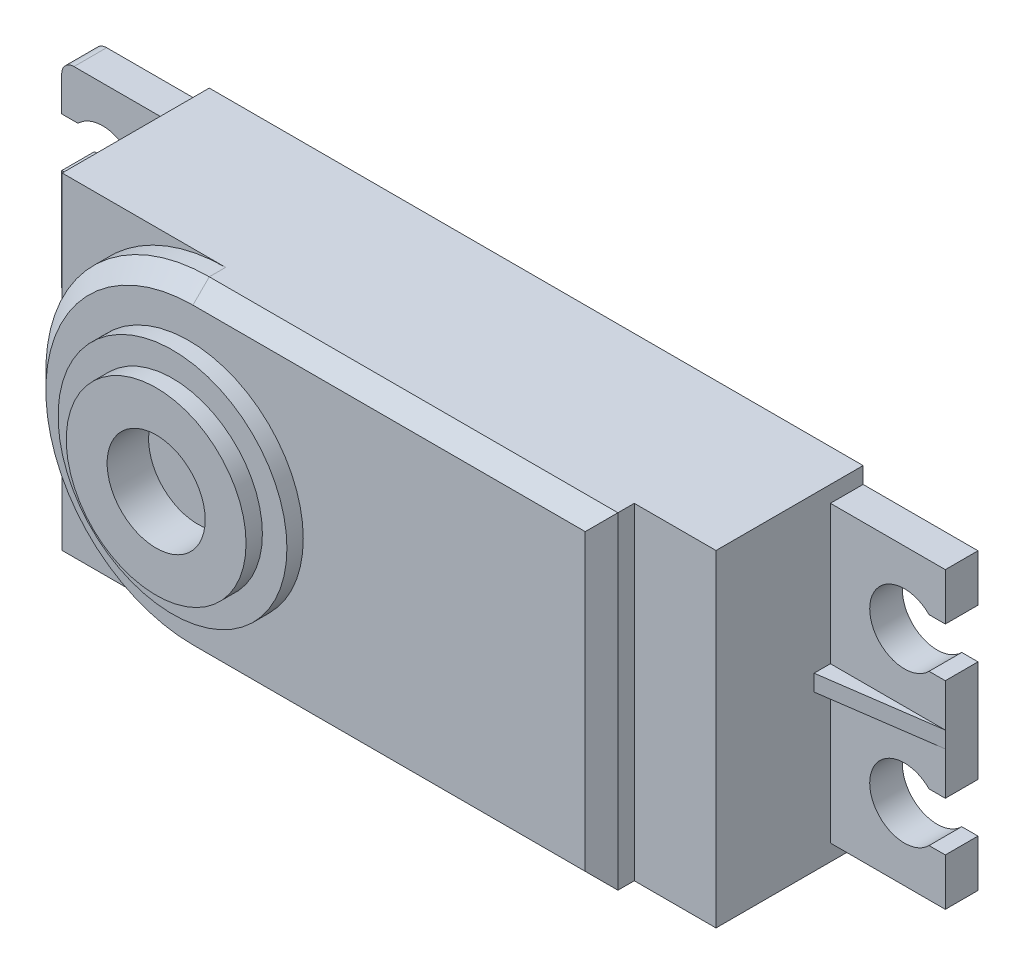
from build123d import *

# Parameters (mm, degrees)
SKETCH1_W           = 39.99992
SKETCH1_H           = 19.99996
BOSS_EXTRUDE1_DEPTH = 9.0000074
BOSS_EXTRUDE2_DEPTH = 2.00000108
CHAMFER2_SIZE       = 1.00000054
SKETCH3_R           = 6.9999987
BOSS_EXTRUDE3_DEPTH = 1.00000054
SKETCH4_R           = 5.5000017
BOSS_EXTRUDE4_DEPTH = 1.00000054
SKETCH5_R           = 2.999994
CUT_EXTRUDE1_DEPTH  = 2.54
BOSS_EXTRUDE5_DEPTH = 1.999996
FILLET1_R           = 0.7500112
BOSS_EXTRUDE6_DEPTH = 0.50000027


with BuildPart() as part:
    # Sketch1 → Boss-Extrude1 (new body)
    with BuildSketch(Plane.XY):
        Rectangle(SKETCH1_W, SKETCH1_H)
    extrude(amount=BOSS_EXTRUDE1_DEPTH)

    # Sketch2 → Boss-Extrude2 (add)
    with BuildSketch(Plane.XY.offset(9.0000074)):
        with BuildLine():
            Line((14.99997, 9.99998), (-9.99998, 9.99998))
            ThreePointArc((-9.99998, 9.99998), (-19.99996, 0), (-9.99998, -9.99998))
            Line((-9.99998, -9.99998), (14.99997, -9.99998))
            Line((14.99997, -9.99998), (14.99997, 9.99998))
        make_face()
    extrude(amount=BOSS_EXTRUDE2_DEPTH)

    # Chamfer2
    chamfer2_edges = [part.edges().sort_by_distance(p)[0] for p in [
        (2.499995, -9.99998, 11.00000848),
        (-19.99996, 0, 11.00000848),
        (2.499995, 9.99998, 11.00000848),
        (14.99997, 0, 11.00000848),
    ]]
    chamfer(chamfer2_edges, length=CHAMFER2_SIZE)

    # Sketch3 → Boss-Extrude3 (add)
    with BuildSketch(Plane.XY.offset(11.00000848)):
        with Locations((-10.24995918, 0)):
            Circle(SKETCH3_R)
    extrude(amount=BOSS_EXTRUDE3_DEPTH)

    # Sketch4 → Boss-Extrude4 (add)
    with BuildSketch(Plane.XY.offset(12.00000902)):
        with Locations((-10.24995918, 0)):
            Circle(SKETCH4_R)
    extrude(amount=BOSS_EXTRUDE4_DEPTH)

    # Sketch5 → Cut-Extrude1 (cut)
    with BuildSketch(Plane.XY.offset(13.00000956)):
        with Locations((-10.24995918, 0)):
            Circle(SKETCH5_R)
    extrude(amount=-CUT_EXTRUDE1_DEPTH, mode=Mode.SUBTRACT)

    # Sketch6 → Boss-Extrude5 (add)
    with BuildSketch(Plane(origin=(0, 0, 0), x_dir=(-1, 0, 0), z_dir=(0, 0, -1))):
        with BuildLine():
            Line((27.027886, 8.99997946), (19.99996, 8.99997946))
            Line((19.99996, 8.99997946), (19.99996, -8.99997946))
            Line((19.99996, -8.99997946), (27.027886, -8.99997946))
            Line((27.027886, -8.99997946), (27.027886, -6.115627342))
            Line((27.027886, -6.115627342), (26.033157804, -6.115627342))
            ThreePointArc((26.033157804, -6.115627342), (22.40296035, -4.615626532), (26.033157804, -3.115625722))
            Line((26.033157804, -3.115625722), (27.027886, -3.115625722))
            Line((27.027886, -3.115625722), (27.027886, 3.115623182))
            Line((27.027886, 3.115623182), (26.033157804, 3.115623182))
            ThreePointArc((26.033157804, 3.115623182), (22.40296035, 4.615623992), (26.033157804, 6.115624802))
            Line((26.033157804, 6.115624802), (27.027886, 6.115624802))
            Line((27.027886, 6.115624802), (27.027886, 8.99997946))
        make_face()
    boss_extrude5 = extrude(amount=-BOSS_EXTRUDE5_DEPTH)

    # Fillet1
    fillet1_edges = [part.edges().sort_by_distance(p)[0] for p in [
        (-27.027886, -8.99997946, 0.999998),
        (-27.027886, 8.99997946, 0.999998),
    ]]
    fillet(fillet1_edges, radius=FILLET1_R)

    # Sketch7 → Boss-Extrude6 (add, symmetric)
    with BuildSketch(Plane(origin=(0, 0, 0), x_dir=(1, 0, 0), z_dir=(0, 1, 0))):
        Polygon((-27.027886, -1.999996), (-19.99996, -2.99999654), (-19.99996, -1.999996), align=None)
    boss_extrude6 = extrude(amount=BOSS_EXTRUDE6_DEPTH, both=True)

    # Mirror1: Boss-Extrude5, Boss-Extrude6 across plane
    add(boss_extrude5.mirror(Plane(origin=(0, 0, 0), x_dir=(0, 0, 1), z_dir=(1, 0, 0))))
    add(boss_extrude6.mirror(Plane(origin=(0, 0, 0), x_dir=(0, 0, 1), z_dir=(1, 0, 0))))


solid = part.part
